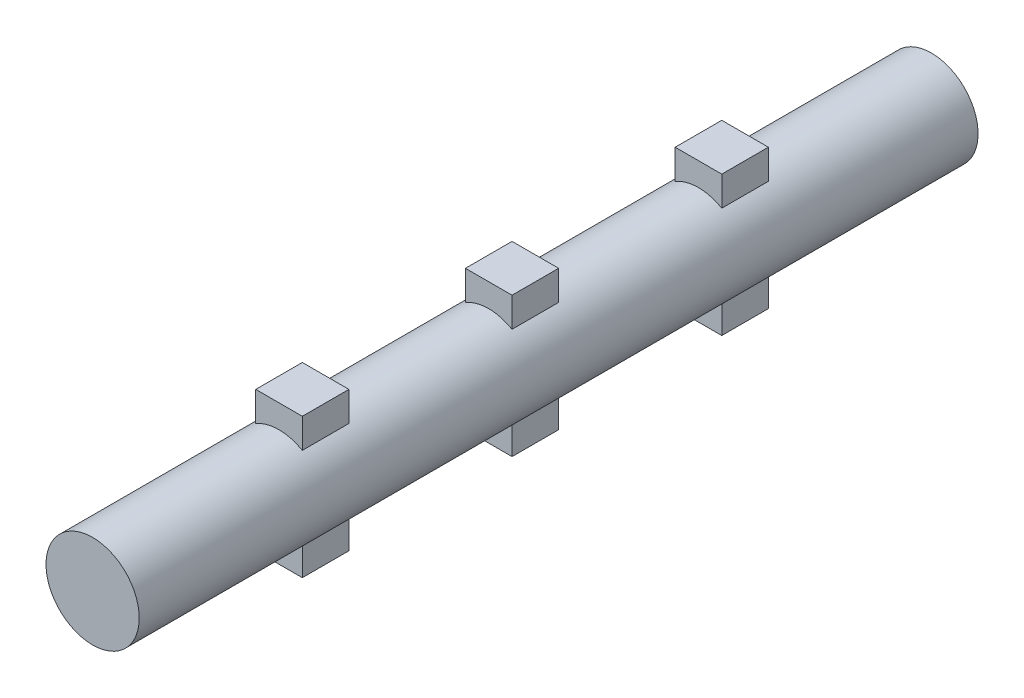
from build123d import *

# Parameters (mm, degrees)
SKETCH1_R             = 5
BOSS_EXTRUDE1_DEPTH   = 25
SKETCH2_W             = 5
SKETCH2_H             = 15
BOSS_EXTRUDE2_DEPTH   = 5
SKETCH3_W             = 5
SKETCH3_H             = 15
BOSS_EXTRUDE3_DEPTH   = 2.5
SKETCH5_W             = 5
SKETCH5_H             = 15
BOSS_EXTRUDE5_DEPTH   = 2.5
BOSS_EXTRUDE6_START   = 25
SKETCH6_R             = 5
BOSS_EXTRUDE6_DEPTH   = 25
SKETCH7_W             = 5
SKETCH7_H             = 15
BOSS_EXTRUDE7_DEPTH   = 5
F_5_0MM_DOWEL_HOLE1_D = 5
BOSS_EXTRUDE8_START   = 20
SKETCH14_R            = 5
BOSS_EXTRUDE8_DEPTH   = 20
SKETCH15_R            = 5
BOSS_EXTRUDE9_DEPTH   = 20


with BuildPart() as part:
    # Sketch1 → Boss-Extrude1 (new body)
    with BuildSketch(Plane.XY):
        with Locations(Location((0, 0, 0), (0, 0, 180))):
            Circle(SKETCH1_R)
    extrude(amount=BOSS_EXTRUDE1_DEPTH)

    # Sketch2 → Boss-Extrude2 (add)
    with BuildSketch(Plane.XY.offset(25)):
        Rectangle(SKETCH2_W, SKETCH2_H)
    extrude(amount=-BOSS_EXTRUDE2_DEPTH)

    # Sketch3 → Boss-Extrude3 (add)
    with BuildSketch(Plane(origin=(0, 0, 0), x_dir=(-1, 0, 0), z_dir=(0, 0, -1))):
        Rectangle(SKETCH3_W, SKETCH3_H)
    extrude(amount=-BOSS_EXTRUDE3_DEPTH)

    # Sketch5 → Boss-Extrude5 (add)
    with BuildSketch(Plane(origin=(0, 0, 0), x_dir=(-1, 0, 0), z_dir=(0, 0, -1))):
        Rectangle(SKETCH5_W, SKETCH5_H)
    extrude(amount=BOSS_EXTRUDE5_DEPTH)

    # Sketch6 → Boss-Extrude6 (add)
    with BuildSketch(Plane(origin=(0, 0, 0), x_dir=(-1, 0, 0), z_dir=(0, 0, -1)).offset(BOSS_EXTRUDE6_START)):
        Circle(SKETCH6_R)
    extrude(amount=-BOSS_EXTRUDE6_DEPTH)

    # Sketch7 → Boss-Extrude7 (add)
    with BuildSketch(Plane(origin=(0, 0, -25), x_dir=(-1, 0, 0), z_dir=(0, 0, -1))):
        Rectangle(SKETCH7_W, SKETCH7_H)
    extrude(amount=-BOSS_EXTRUDE7_DEPTH)

    # Ø5.0mm Dowel Hole1 (through all)
    with Locations(Plane.XY.offset(25)):
        with Locations((0, 0)):
            Hole(F_5_0MM_DOWEL_HOLE1_D / 2)

    # Sketch14 → Boss-Extrude8 (add)
    with BuildSketch(Plane(origin=(0, 0, -25), x_dir=(-1, 0, 0), z_dir=(0, 0, -1)).offset(BOSS_EXTRUDE8_START)):
        Circle(SKETCH14_R)
    extrude(amount=-BOSS_EXTRUDE8_DEPTH)

    # Sketch15 → Boss-Extrude9 (add)
    with BuildSketch(Plane.XY.offset(25)):
        with Locations(Location((0, 0, 0), (0, 0, 180))):
            Circle(SKETCH15_R)
    extrude(amount=BOSS_EXTRUDE9_DEPTH)


solid = part.part
